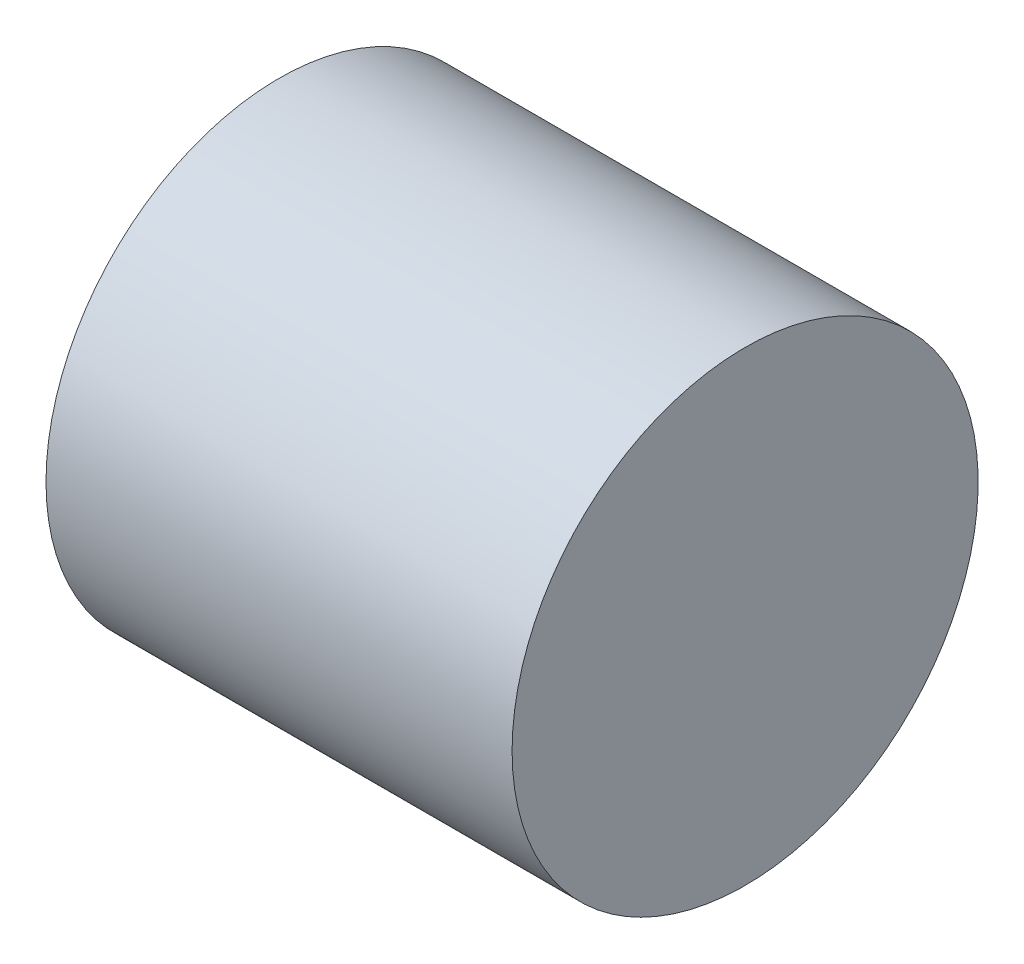
from build123d import *

# Parameters (mm, degrees)
ESBO_O2_R                = 45
RESSALTO_EXTRUS_O2_DEPTH = 45


with BuildPart() as part:
    # Esboço2 → Ressalto-extrusão2 (new, symmetric)
    with BuildSketch(Plane(origin=(0, 0, 0), x_dir=(0, 0, -1), z_dir=(1, 0, 0))):
        with Locations(Location((0, 0, 0), (0, 0, 180))):
            Circle(ESBO_O2_R)
    extrude(amount=RESSALTO_EXTRUS_O2_DEPTH, both=True)


solid = part.part
